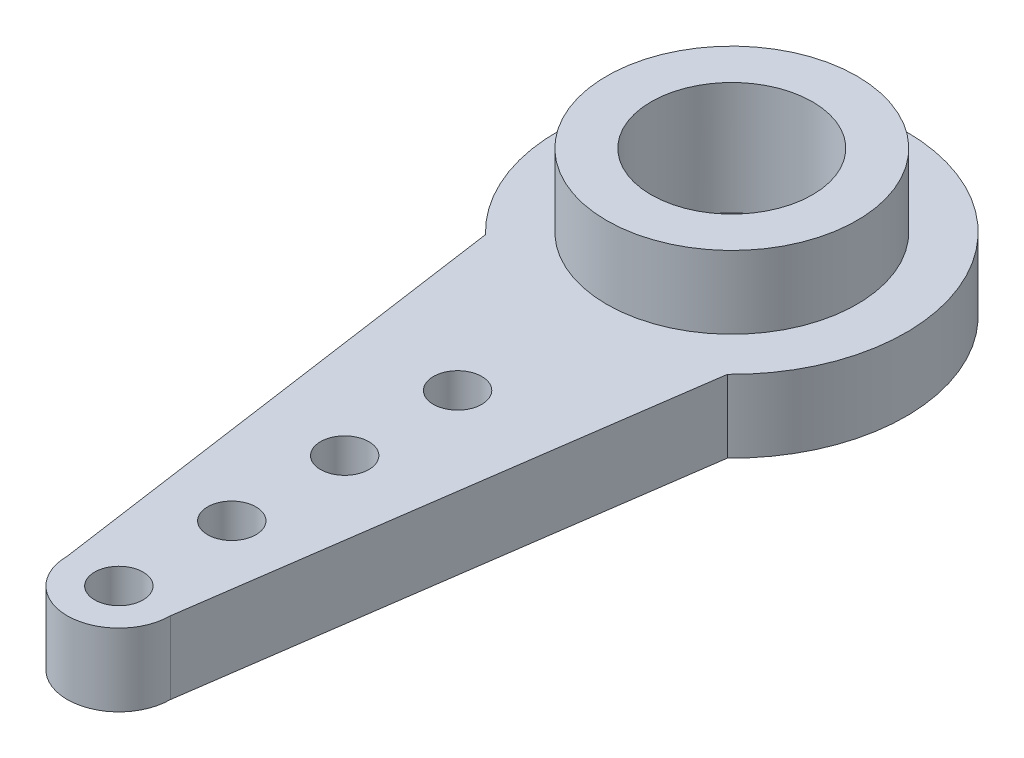
from build123d import *

# Parameters (mm, degrees)
SKETCH1_R           = 2.5
SKETCH1_R_2         = 0.75
BOSS_EXTRUDE1_DEPTH = 2.25
SKETCH2_R           = 3.879501895
SKETCH2_R_2         = 2.5
BOSS_EXTRUDE2_DEPTH = 2.25
SKETCH3_R           = 2.5
SKETCH3_R_2         = 2.008527967
BOSS_EXTRUDE3_DEPTH = 1
SKETCH4_R           = 3.8
SKETCH4_R_2         = 3
CUT_EXTRUDE1_DEPTH  = 0.5
CUT_EXTRUDE2_DEPTH  = 22.766258291


with BuildPart() as part:
    # Sketch1 → Boss-Extrude1 (new body)
    with BuildSketch(Plane(origin=(0, 0, 0), x_dir=(1, 0, 0), z_dir=(0, 1, 0))):
        with BuildLine():
            Line((-1.6, 19), (-3.75, 3.885550154))
            ThreePointArc((-3.75, 3.885550154), (-5.4, 0), (-3.75, -3.885550154))
            Line((-3.75, -3.885550154), (-1.6, -19))
            ThreePointArc((-1.6, -19), (0, -20.6), (1.6, -19))
            Line((1.6, -19), (3.75, -3.885550154))
            ThreePointArc((3.75, -3.885550154), (5.4, 0), (3.75, 3.885550154))
            Line((3.75, 3.885550154), (1.6, 19))
            ThreePointArc((1.6, 19), (0, 20.6), (-1.6, 19))
        make_face()
        with Locations(Location((0, 0, 0), (0, 0, 270))):
            Circle(SKETCH1_R, mode=Mode.SUBTRACT)
        with Locations(Location((0, -19, 0), (0, 0, 270))):
            Circle(SKETCH1_R_2, mode=Mode.SUBTRACT)
        with Locations(Location((0, 19, 0), (0, 0, 270))):
            Circle(SKETCH1_R_2, mode=Mode.SUBTRACT)
        with Locations(Location((0, 15.5, 0), (0, 0, 270))):
            Circle(SKETCH1_R_2, mode=Mode.SUBTRACT)
        with Locations(Location((0, 12, 0), (0, 0, 270))):
            Circle(SKETCH1_R_2, mode=Mode.SUBTRACT)
        with Locations(Location((0, 8.5, 0), (0, 0, 270))):
            Circle(SKETCH1_R_2, mode=Mode.SUBTRACT)
        with Locations(Location((0, -15.5, 0), (0, 0, 270))):
            Circle(SKETCH1_R_2, mode=Mode.SUBTRACT)
        with Locations(Location((0, -12, 0), (0, 0, 270))):
            Circle(SKETCH1_R_2, mode=Mode.SUBTRACT)
        with Locations(Location((0, -8.5, 0), (0, 0, 270))):
            Circle(SKETCH1_R_2, mode=Mode.SUBTRACT)
    extrude(amount=BOSS_EXTRUDE1_DEPTH)

    # Sketch2 → Boss-Extrude2 (add)
    with BuildSketch(Plane(origin=(0, 2.25, 0), x_dir=(1, 0, 0), z_dir=(0, 1, 0))):
        with Locations(Location((0, 0, 0), (0, 0, 270))):
            Circle(SKETCH2_R)
        with Locations(Location((0, 0, 0), (0, 0, 270))):
            Circle(SKETCH2_R_2, mode=Mode.SUBTRACT)
    extrude(amount=BOSS_EXTRUDE2_DEPTH)

    # Sketch3 → Boss-Extrude3 (add)
    with BuildSketch(Plane.XZ):
        with Locations(Location((0, 0, 0), (0, 0, 270))):
            Circle(SKETCH3_R)
        with Locations(Location((0, 0, 0), (0, 0, 270))):
            Circle(SKETCH3_R_2, mode=Mode.SUBTRACT)
    extrude(amount=-BOSS_EXTRUDE3_DEPTH)

    # Sketch4 → Cut-Extrude1 (cut)
    with BuildSketch(Plane.XZ):
        with Locations(Location((0, 0, 0), (0, 0, 270))):
            Circle(SKETCH4_R)
        with Locations(Location((0, 0, 0), (0, 0, 270))):
            Circle(SKETCH4_R_2, mode=Mode.SUBTRACT)
    extrude(amount=-CUT_EXTRUDE1_DEPTH, mode=Mode.SUBTRACT)

    # Sketch5 → Cut-Extrude2 (cut, through all)
    with BuildSketch(Plane.XZ):
        with BuildLine():
            Line((-3.75, -3.885550154), (-1.6, -19))
            ThreePointArc((-1.6, -19), (0, -20.6), (1.6, -19))
            Line((1.6, -19), (3.75, -3.885550154))
            ThreePointArc((3.75, -3.885550154), (0, -5.4), (-3.75, -3.885550154))
        make_face()
    extrude(amount=-CUT_EXTRUDE2_DEPTH, mode=Mode.SUBTRACT)


solid = part.part
